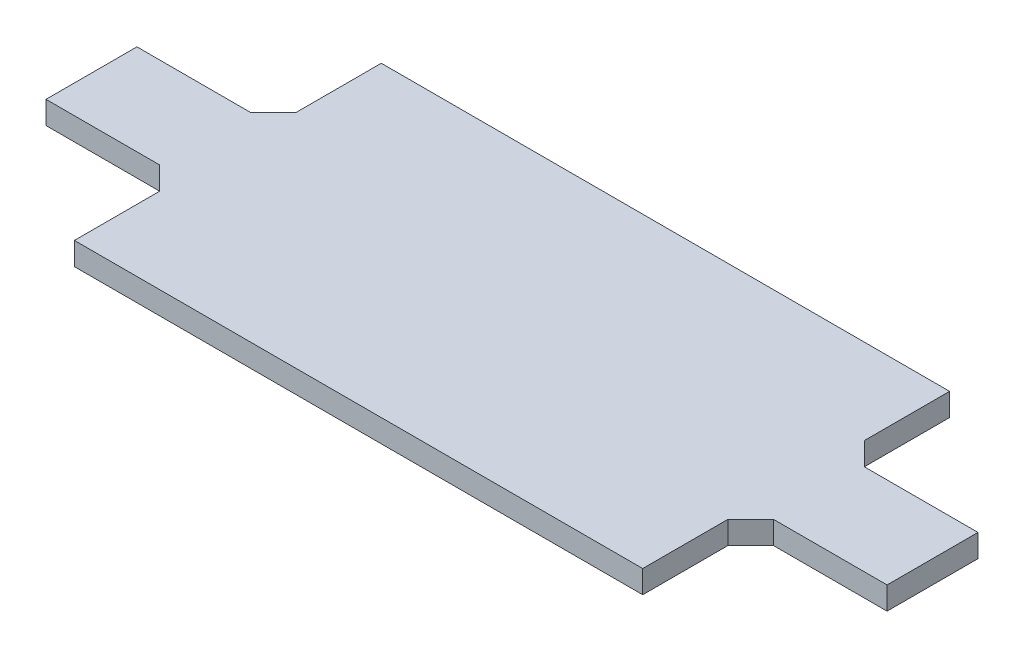
from build123d import *

# Parameters (mm, degrees)
BOSS_EXTRUDE1_DEPTH = 10
CHAMFER1_SIZE       = 10


with BuildPart() as part:
    # Sketch1 → Boss-Extrude1 (new body)
    with BuildSketch(Plane(origin=(0, 0, 0), x_dir=(1, 0, 0), z_dir=(0, 1, 0))):
        Polygon((125, -20), (125, -67.5), (-125, -67.5), (-125, -20), (-185, -20), (-185, 20), (-125, 20), (-125, 67.5), (125, 67.5), (125, 20), (185, 20), (185, -20), align=None)
    extrude(amount=BOSS_EXTRUDE1_DEPTH)

    # Chamfer1
    chamfer1_edges = [part.edges().sort_by_distance(p)[0] for p in [
        (-125, 5, 20),
        (-125, 5, -20),
        (125, 5, -20),
        (125, 5, 20),
    ]]
    chamfer(chamfer1_edges, length=CHAMFER1_SIZE)


solid = part.part
